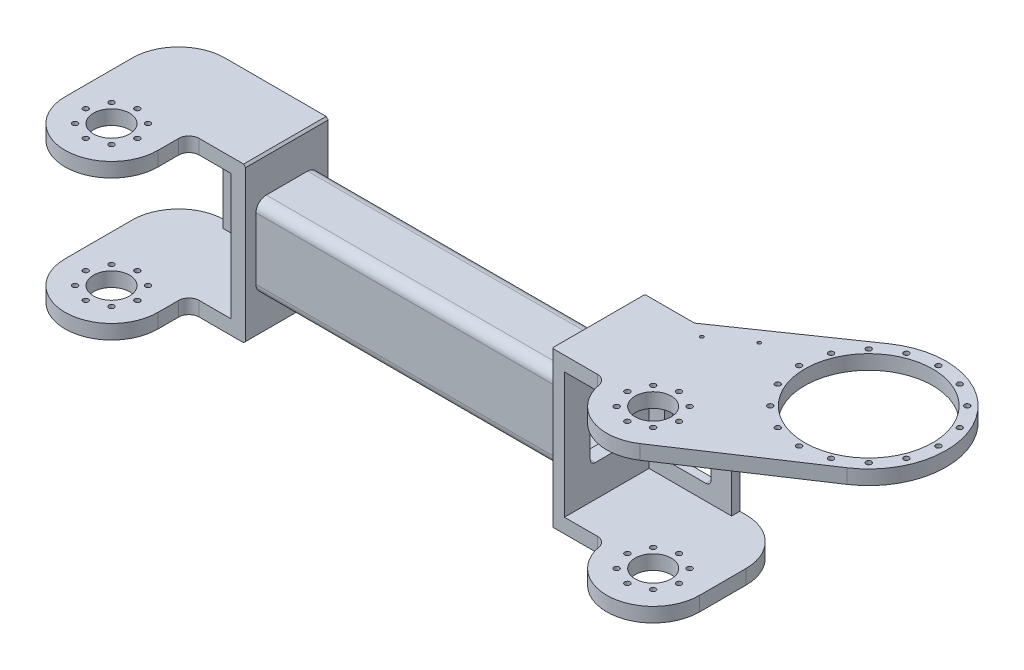
from build123d import *

# Parameters (mm, degrees)
EXTRUDE_1_DEPTH      = 75
SKETCH_2_W           = 300
SKETCH_2_H           = 122
CUT_EXTRUDE_1_DEPTH  = 100
SKETCH_3_R           = 17.5
CUT_EXTRUDE_2_DEPTH  = 240
SKETCH_4_R           = 2.55
CUT_EXTRUDE_3_DEPTH  = 240
EXTRUDE_4_DEPTH      = 75
EXTRUDE_5_DEPTH      = 300
SKETCH_10_W          = 200
SKETCH_10_H          = 122
CUT_EXTRUDE_4_DEPTH  = 100
CUT_EXTRUDE_5_REACH  = 485.477
SKETCH_11_R          = 17.5
CUT_EXTRUDE_6_REACH  = 485.477
SKETCH_12_R          = 2.55
EXTRUDE_6_DEPTH      = 14
SKETCH_14_R          = 62
CUT_EXTRUDE_7_DEPTH  = 14
SKETCH_15_R          = 2.55
CUT_EXTRUDE_8_DEPTH  = 14
CUT_EXTRUDE_9_REACH  = 614.705
SKETCH_17_R          = 1.7
CUT_EXTRUDE_10_DEPTH = 14
SKETCH_18_W          = 8
SKETCH_18_H          = 122
EXTRUDE_7_DEPTH      = 80
CUT_EXTRUDE_11_DEPTH = 8
SKETCH_20_W          = 8
SKETCH_20_H          = 122
EXTRUDE_8_DEPTH      = 80
CUT_EXTRUDE_12_DEPTH = 8
SKETCH_22_R          = 1.7
CUT_EXTRUDE_13_DEPTH = 10
CHAMFER_1_SIZE       = 2
SKETCH_23_R          = 1.7
CUT_EXTRUDE_14_DEPTH = 10
CHAMFER_2_SIZE       = 3


with BuildPart() as part:
    # 草图1 → 凸台-拉伸1 (new, symmetric)
    with BuildSketch(Plane(origin=(0, 0, 0), x_dir=(1, 0, 0), z_dir=(0, 1, 0))):
        with BuildLine():
            Line((-100, 40), (0, 40))
            Line((0, 40), (0, -40))
            Line((0, -40), (-45, -40))
            ThreePointArc((-45, -40), (-52.071067812, -42.928932188), (-55, -50))
            Line((-55, -50), (-55, -70))
            ThreePointArc((-55, -70), (-100, -115), (-145, -70))
            Line((-145, -70), (-145, -5))
            ThreePointArc((-145, -5), (-131.819805153, 26.819805153), (-100, 40))
        make_face()
    extrude(amount=EXTRUDE_1_DEPTH, both=True)

    # 草图2 → 切除-拉伸1 (cut, symmetric)
    with BuildSketch(Plane.XY.offset(40)):
        with Locations((-164, 0)):
            Rectangle(SKETCH_2_W, SKETCH_2_H)
    extrude(amount=CUT_EXTRUDE_1_DEPTH, both=True, mode=Mode.SUBTRACT)

    # 草图3 → 切除-拉伸2 (cut)
    with BuildSketch(Plane(origin=(0, 75, 0), x_dir=(1, 0, 0), z_dir=(0, 1, 0))):
        with Locations(Location((-100, -70, 0), (0, 0, 270))):
            Circle(SKETCH_3_R)
    extrude(amount=-CUT_EXTRUDE_2_DEPTH, mode=Mode.SUBTRACT)

    # 草图4 → 切除-拉伸3 (cut)
    with BuildSketch(Plane.XZ.offset(75)):
        with Locations(Location((-100, 95, 0), (0, 0, 270))):
            Circle(SKETCH_4_R)
        with Locations(Location((-117.67766953, 87.67766953, 0), (0, 0, 270))):
            Circle(SKETCH_4_R)
        with Locations(Location((-125, 70, 0), (0, 0, 270))):
            Circle(SKETCH_4_R)
        with Locations(Location((-117.67766953, 52.32233047, 0), (0, 0, 270))):
            Circle(SKETCH_4_R)
        with Locations(Location((-100, 45, 0), (0, 0, 270))):
            Circle(SKETCH_4_R)
        with Locations(Location((-82.32233047, 52.32233047, 0), (0, 0, 270))):
            Circle(SKETCH_4_R)
        with Locations(Location((-75, 70, 0), (0, 0, 270))):
            Circle(SKETCH_4_R)
        with Locations(Location((-82.32233047, 87.67766953, 0), (0, 0, 270))):
            Circle(SKETCH_4_R)
    extrude(amount=-CUT_EXTRUDE_3_DEPTH, mode=Mode.SUBTRACT)



with BuildPart() as body_2:
    # 草图8 → 凸台-拉伸4 (new, symmetric)
    with BuildSketch(Plane(origin=(0, 0, 0), x_dir=(1, 0, 0), z_dir=(0, 1, 0))):
        with BuildLine():
            Line((400, 45), (300, 45))
            Line((300, 45), (300, -45))
            Line((300, -45), (345.916730868, -45))
            ThreePointArc((345.916730868, -45), (352.312752359, -47.312938852), (355.750052528, -53.181818182))
            ThreePointArc((355.750052528, -53.181818182), (404.108063034, -89.812094552), (445, -45))
            Line((445, -45), (445, 0))
            ThreePointArc((445, 0), (431.819805153, 31.819805153), (400, 45))
        make_face()
    extrude(amount=EXTRUDE_4_DEPTH, both=True)


with BuildPart() as part_1:
    add(part.part)

    add(body_2.part)  # 凸台-拉伸5 merges body 2
    # 草图9 → 凸台-拉伸5 (add)
    with BuildSketch(Plane(origin=(0, 0, 0), x_dir=(0, 0, -1), z_dir=(1, 0, 0))):
        with BuildLine():
            Line((-20, 40), (20, 40))
            ThreePointArc((20, 40), (27.071067812, 37.071067812), (30, 30))
            Line((30, 30), (30, -30))
            ThreePointArc((30, -30), (27.071067812, -37.071067812), (20, -40))
            Line((20, -40), (-20, -40))
            ThreePointArc((-20, -40), (-27.071067812, -37.071067812), (-30, -30))
            Line((-30, -30), (-30, 30))
            ThreePointArc((-30, 30), (-27.071067812, 37.071067812), (-20, 40))
        make_face()
        with BuildLine():
            Line((26, 30), (26, -30))
            ThreePointArc((26, -30), (24.242640687, -34.242640687), (20, -36))
            Line((20, -36), (-20, -36))
            ThreePointArc((-20, -36), (-24.242640687, -34.242640687), (-26, -30))
            Line((-26, -30), (-26, 30))
            ThreePointArc((-26, 30), (-24.242640687, 34.242640687), (-20, 36))
            Line((-20, 36), (20, 36))
            ThreePointArc((20, 36), (24.242640687, 34.242640687), (26, 30))
        make_face(mode=Mode.SUBTRACT)
    extrude(amount=EXTRUDE_5_DEPTH)

    # 草图10 → 切除-拉伸4 (cut, symmetric)
    with BuildSketch(Plane.XY.offset(45)):
        with Locations((414, 0)):
            Rectangle(SKETCH_10_W, SKETCH_10_H)
    extrude(amount=CUT_EXTRUDE_4_DEPTH, both=True, mode=Mode.SUBTRACT)

    # 切除-拉伸5: up to this face of the body (flat: up to its plane)
    cut_extrude_5_end = Plane(part_1.part.faces().sort_by_distance((376.296187355, -75, 13.901969923))[0])
    # 草图11 → 切除-拉伸5 (cut, up to the picked face)
    with BuildSketch(Plane(origin=(0, 75, 0), x_dir=(1, 0, 0), z_dir=(0, 1, 0)), mode=Mode.PRIVATE) as cut_extrude_5_sk1:
        with Locations(Location((400, -45, 0), (0, 0, 270))):
            Circle(SKETCH_11_R)
    cut_extrude_5_tool1 = split(extrude(cut_extrude_5_sk1.sketch, amount=-CUT_EXTRUDE_5_REACH, mode=Mode.PRIVATE), bisect_by=cut_extrude_5_end, keep=Keep.BOTH, mode=Mode.PRIVATE)
    add(cut_extrude_5_tool1.solids().sort_by(Axis((400, 75, 45), (0, -1, 0)))[0], mode=Mode.SUBTRACT)

    # 切除-拉伸6: up to this face of the body (flat: up to its plane)
    cut_extrude_6_end = Plane(part_1.part.faces().sort_by_distance((374.760455412, -75, 11.887178511))[0])
    # 草图12 → 切除-拉伸6 (cut, up to the picked face)
    with BuildSketch(Plane(origin=(0, 75, 0), x_dir=(1, 0, 0), z_dir=(0, 1, 0)), mode=Mode.PRIVATE) as cut_extrude_6_sk1:
        with Locations(Location((375, -45, 0), (0, 0, 270))):
            Circle(SKETCH_12_R)
    cut_extrude_6_tool1 = split(extrude(cut_extrude_6_sk1.sketch, amount=-CUT_EXTRUDE_6_REACH, mode=Mode.PRIVATE), bisect_by=cut_extrude_6_end, keep=Keep.BOTH, mode=Mode.PRIVATE)
    # 草图12 → 切除-拉伸6 (cut, up to the picked face)
    with BuildSketch(Plane(origin=(0, 75, 0), x_dir=(1, 0, 0), z_dir=(0, 1, 0)), mode=Mode.PRIVATE) as cut_extrude_6_sk2:
        with Locations(Location((382.32233047, -62.67766953, 0), (0, 0, 270))):
            Circle(SKETCH_12_R)
    cut_extrude_6_tool2 = split(extrude(cut_extrude_6_sk2.sketch, amount=-CUT_EXTRUDE_6_REACH, mode=Mode.PRIVATE), bisect_by=cut_extrude_6_end, keep=Keep.BOTH, mode=Mode.PRIVATE)
    # 草图12 → 切除-拉伸6 (cut, up to the picked face)
    with BuildSketch(Plane(origin=(0, 75, 0), x_dir=(1, 0, 0), z_dir=(0, 1, 0)), mode=Mode.PRIVATE) as cut_extrude_6_sk3:
        with Locations(Location((400, -70, 0), (0, 0, 270))):
            Circle(SKETCH_12_R)
    cut_extrude_6_tool3 = split(extrude(cut_extrude_6_sk3.sketch, amount=-CUT_EXTRUDE_6_REACH, mode=Mode.PRIVATE), bisect_by=cut_extrude_6_end, keep=Keep.BOTH, mode=Mode.PRIVATE)
    # 草图12 → 切除-拉伸6 (cut, up to the picked face)
    with BuildSketch(Plane(origin=(0, 75, 0), x_dir=(1, 0, 0), z_dir=(0, 1, 0)), mode=Mode.PRIVATE) as cut_extrude_6_sk4:
        with Locations(Location((417.67766953, -62.67766953, 0), (0, 0, 270))):
            Circle(SKETCH_12_R)
    cut_extrude_6_tool4 = split(extrude(cut_extrude_6_sk4.sketch, amount=-CUT_EXTRUDE_6_REACH, mode=Mode.PRIVATE), bisect_by=cut_extrude_6_end, keep=Keep.BOTH, mode=Mode.PRIVATE)
    # 草图12 → 切除-拉伸6 (cut, up to the picked face)
    with BuildSketch(Plane(origin=(0, 75, 0), x_dir=(1, 0, 0), z_dir=(0, 1, 0)), mode=Mode.PRIVATE) as cut_extrude_6_sk5:
        with Locations(Location((425, -45, 0), (0, 0, 270))):
            Circle(SKETCH_12_R)
    cut_extrude_6_tool5 = split(extrude(cut_extrude_6_sk5.sketch, amount=-CUT_EXTRUDE_6_REACH, mode=Mode.PRIVATE), bisect_by=cut_extrude_6_end, keep=Keep.BOTH, mode=Mode.PRIVATE)
    # 草图12 → 切除-拉伸6 (cut, up to the picked face)
    with BuildSketch(Plane(origin=(0, 75, 0), x_dir=(1, 0, 0), z_dir=(0, 1, 0)), mode=Mode.PRIVATE) as cut_extrude_6_sk6:
        with Locations(Location((417.67766953, -27.32233047, 0), (0, 0, 270))):
            Circle(SKETCH_12_R)
    cut_extrude_6_tool6 = split(extrude(cut_extrude_6_sk6.sketch, amount=-CUT_EXTRUDE_6_REACH, mode=Mode.PRIVATE), bisect_by=cut_extrude_6_end, keep=Keep.BOTH, mode=Mode.PRIVATE)
    # 草图12 → 切除-拉伸6 (cut, up to the picked face)
    with BuildSketch(Plane(origin=(0, 75, 0), x_dir=(1, 0, 0), z_dir=(0, 1, 0)), mode=Mode.PRIVATE) as cut_extrude_6_sk7:
        with Locations(Location((400, -20, 0), (0, 0, 270))):
            Circle(SKETCH_12_R)
    cut_extrude_6_tool7 = split(extrude(cut_extrude_6_sk7.sketch, amount=-CUT_EXTRUDE_6_REACH, mode=Mode.PRIVATE), bisect_by=cut_extrude_6_end, keep=Keep.BOTH, mode=Mode.PRIVATE)
    # 草图12 → 切除-拉伸6 (cut, up to the picked face)
    with BuildSketch(Plane(origin=(0, 75, 0), x_dir=(1, 0, 0), z_dir=(0, 1, 0)), mode=Mode.PRIVATE) as cut_extrude_6_sk8:
        with Locations(Location((382.32233047, -27.32233047, 0), (0, 0, 270))):
            Circle(SKETCH_12_R)
    cut_extrude_6_tool8 = split(extrude(cut_extrude_6_sk8.sketch, amount=-CUT_EXTRUDE_6_REACH, mode=Mode.PRIVATE), bisect_by=cut_extrude_6_end, keep=Keep.BOTH, mode=Mode.PRIVATE)
    add(cut_extrude_6_tool1.solids().sort_by(Axis((375, 75, 45), (0, -1, 0)))[0], mode=Mode.SUBTRACT)
    add(cut_extrude_6_tool2.solids().sort_by(Axis((382.32233, 75, 62.67767), (0, -1, 0)))[0], mode=Mode.SUBTRACT)
    add(cut_extrude_6_tool3.solids().sort_by(Axis((400, 75, 70), (0, -1, 0)))[0], mode=Mode.SUBTRACT)
    add(cut_extrude_6_tool4.solids().sort_by(Axis((417.67767, 75, 62.67767), (0, -1, 0)))[0], mode=Mode.SUBTRACT)
    add(cut_extrude_6_tool5.solids().sort_by(Axis((425, 75, 45), (0, -1, 0)))[0], mode=Mode.SUBTRACT)
    add(cut_extrude_6_tool6.solids().sort_by(Axis((417.67767, 75, 27.32233), (0, -1, 0)))[0], mode=Mode.SUBTRACT)
    add(cut_extrude_6_tool7.solids().sort_by(Axis((400, 75, 20), (0, -1, 0)))[0], mode=Mode.SUBTRACT)
    add(cut_extrude_6_tool8.solids().sort_by(Axis((382.32233, 75, 27.32233), (0, -1, 0)))[0], mode=Mode.SUBTRACT)

    # 草图13 → 凸台-拉伸6 (add)
    with BuildSketch(Plane(origin=(0, 75, 0), x_dir=(1, 0, 0), z_dir=(0, 1, 0))):
        with BuildLine():
            Line((545.404349124, -2.484411614), (424.888780402, -82.490646968))
            ThreePointArc((424.888780402, -82.490646968), (439.65472934, -66.272104761), (445, -45))
            Line((445, -45), (445, 0))
            ThreePointArc((445, 0), (431.819805153, 31.819805153), (400, 45))
            Line((400, 45), (350, 45))
            Line((350, 45), (461.360881331, 121.753234164))
            ThreePointArc((461.360881331, 121.753234164), (566.044222181, 102.023324176), (545.404349124, -2.484411614))
        make_face()
    extrude(amount=-EXTRUDE_6_DEPTH)

    # 草图14 → 切除-拉伸7 (cut)
    with BuildSketch(Plane(origin=(0, 75, 0), x_dir=(1, 0, 0), z_dir=(0, 1, 0))):
        with Locations(Location((503.923048454, 60, 0), (0, 0, 270))):
            Circle(SKETCH_14_R)
    extrude(amount=-CUT_EXTRUDE_7_DEPTH, mode=Mode.SUBTRACT)

    # 草图15 → 切除-拉伸8 (cut)
    with BuildSketch(Plane(origin=(0, 75, 0), x_dir=(1, 0, 0), z_dir=(0, 1, 0))):
        with Locations(Location((503.923048454, -7.5, 0), (0, 0, 270))):
            Circle(SKETCH_15_R)
        with Locations(Location((529.754180139, -2.361868445, 0), (0, 0, 270))):
            Circle(SKETCH_15_R)
        with Locations(Location((551.652756184, 12.27029227, 0), (0, 0, 270))):
            Circle(SKETCH_15_R)
        with Locations(Location((566.284916899, 34.168868315, 0), (0, 0, 270))):
            Circle(SKETCH_15_R)
        with Locations(Location((571.423048454, 60, 0), (0, 0, 270))):
            Circle(SKETCH_15_R)
        with Locations(Location((566.284916899, 85.831131685, 0), (0, 0, 270))):
            Circle(SKETCH_15_R)
        with Locations(Location((551.652756184, 107.72970773, 0), (0, 0, 270))):
            Circle(SKETCH_15_R)
        with Locations(Location((529.754180139, 122.361868445, 0), (0, 0, 270))):
            Circle(SKETCH_15_R)
        with Locations(Location((503.923048454, 127.5, 0), (0, 0, 270))):
            Circle(SKETCH_15_R)
        with Locations(Location((478.091916769, 122.361868445, 0), (0, 0, 270))):
            Circle(SKETCH_15_R)
        with Locations(Location((456.193340724, 107.72970773, 0), (0, 0, 270))):
            Circle(SKETCH_15_R)
        with Locations(Location((441.56118001, 85.831131685, 0), (0, 0, 270))):
            Circle(SKETCH_15_R)
        with Locations(Location((436.423048454, 60, 0), (0, 0, 270))):
            Circle(SKETCH_15_R)
        with Locations(Location((441.56118001, 34.168868315, 0), (0, 0, 270))):
            Circle(SKETCH_15_R)
        with Locations(Location((456.193340724, 12.27029227, 0), (0, 0, 270))):
            Circle(SKETCH_15_R)
        with Locations(Location((478.091916769, -2.361868445, 0), (0, 0, 270))):
            Circle(SKETCH_15_R)
    extrude(amount=-CUT_EXTRUDE_8_DEPTH, mode=Mode.SUBTRACT)

    # 切除-拉伸9: up to this face of the body (flat: up to its plane)
    cut_extrude_9_end = Plane(part_1.part.faces().sort_by_distance((314, 0, 0))[0])
    # 草图16 → 切除-拉伸9 (cut, up to the picked face)
    with BuildSketch(Plane.ZY.offset(14), mode=Mode.PRIVATE) as cut_extrude_9_sk1:
        with BuildLine():
            Line((-15, 30), (15, 30))
            ThreePointArc((15, 30), (18.535533906, 28.535533906), (20, 25))
            Line((20, 25), (20, -25))
            ThreePointArc((20, -25), (18.535533906, -28.535533906), (15, -30))
            Line((15, -30), (-15, -30))
            ThreePointArc((-15, -30), (-18.535533906, -28.535533906), (-20, -25))
            Line((-20, -25), (-20, 25))
            ThreePointArc((-20, 25), (-18.535533906, 28.535533906), (-15, 30))
        make_face()
    cut_extrude_9_tool1 = split(extrude(cut_extrude_9_sk1.sketch, amount=-CUT_EXTRUDE_9_REACH, mode=Mode.PRIVATE), bisect_by=cut_extrude_9_end, keep=Keep.BOTH, mode=Mode.PRIVATE)
    add(cut_extrude_9_tool1.solids().sort_by(Axis((-14, 0, 0), (1, 0, 0)))[0], mode=Mode.SUBTRACT)

    # 草图17 → 切除-拉伸10 (cut)
    with BuildSketch(Plane(origin=(0, 75, 0), x_dir=(1, 0, 0), z_dir=(0, 1, 0))):
        with Locations(Location((397.935058221, 59.820599625, 0), (0, 0, 270))):
            Circle(SKETCH_17_R)
        with Locations(Location((365, 37.120777159, 0), (0, 0, 270))):
            Circle(SKETCH_17_R)
    extrude(amount=-CUT_EXTRUDE_10_DEPTH, mode=Mode.SUBTRACT)

    # 草图18 → 凸台-拉伸7 (add)
    with BuildSketch(Plane(origin=(314, 0, 0), x_dir=(0, 0, -1), z_dir=(1, 0, 0))):
        with Locations((41, 0)):
            Rectangle(SKETCH_18_W, SKETCH_18_H)
    extrude(amount=EXTRUDE_7_DEPTH)

    # 草图19 → 切除-拉伸11 (cut)
    with BuildSketch(Plane.XY.offset(-37)):
        with BuildLine():
            Line((334, 46), (369, 46))
            ThreePointArc((369, 46), (372.535533906, 44.535533906), (374, 41))
            Line((374, 41), (374, -41))
            ThreePointArc((374, -41), (372.535533906, -44.535533906), (369, -46))
            Line((369, -46), (334, -46))
            ThreePointArc((334, -46), (330.464466094, -44.535533906), (329, -41))
            Line((329, -41), (329, 41))
            ThreePointArc((329, 41), (330.464466094, 44.535533906), (334, 46))
        make_face()
    extrude(amount=-CUT_EXTRUDE_11_DEPTH, mode=Mode.SUBTRACT)

    # 草图20 → 凸台-拉伸8 (add)
    with BuildSketch(Plane.ZY.offset(14)):
        with Locations((-36, 0)):
            Rectangle(SKETCH_20_W, SKETCH_20_H)
    extrude(amount=EXTRUDE_8_DEPTH)

    # 草图21 → 切除-拉伸12 (cut)
    with BuildSketch(Plane.XY.offset(-32)):
        with BuildLine():
            Line((-64, 46), (-34, 46))
            ThreePointArc((-34, 46), (-26.928932188, 43.071067812), (-24, 36))
            Line((-24, 36), (-24, -36))
            ThreePointArc((-24, -36), (-26.928932188, -43.071067812), (-34, -46))
            Line((-34, -46), (-64, -46))
            ThreePointArc((-64, -46), (-71.071067812, -43.071067812), (-74, -36))
            Line((-74, -36), (-74, 36))
            ThreePointArc((-74, 36), (-71.071067812, 43.071067812), (-64, 46))
        make_face()
    extrude(amount=-CUT_EXTRUDE_12_DEPTH, mode=Mode.SUBTRACT)

    # 草图22 → 切除-拉伸13 (cut)
    with BuildSketch(Plane.XY.offset(-32)):
        with Locations((-84, 25)):
            Circle(SKETCH_22_R)
        with Locations((-84, -25)):
            Circle(SKETCH_22_R)
    extrude(amount=-CUT_EXTRUDE_13_DEPTH, mode=Mode.SUBTRACT)

    # 倒角1
    chamfer_1_edges = [part_1.edges().sort_by_distance(p)[0] for p in [
        (0, 75, 0),
        (300, -75, 0),
        (300, 75, 0),
        (0, -75, 0),
    ]]
    chamfer(chamfer_1_edges, length=CHAMFER_1_SIZE)

    # 草图23 → 切除-拉伸14 (cut)
    with BuildSketch(Plane.XY.offset(-37)):
        with Locations((384, 25)):
            Circle(SKETCH_23_R)
        with Locations((384, -25)):
            Circle(SKETCH_23_R)
    extrude(amount=-CUT_EXTRUDE_14_DEPTH, mode=Mode.SUBTRACT)

    # 倒角2
    chamfer_2_edges = [part_1.edges().sort_by_distance(p)[0] for p in [
        (300, 0, -45),
        (300, 0, 45),
    ]]
    chamfer(chamfer_2_edges, length=CHAMFER_2_SIZE)


solid = part_1.part
